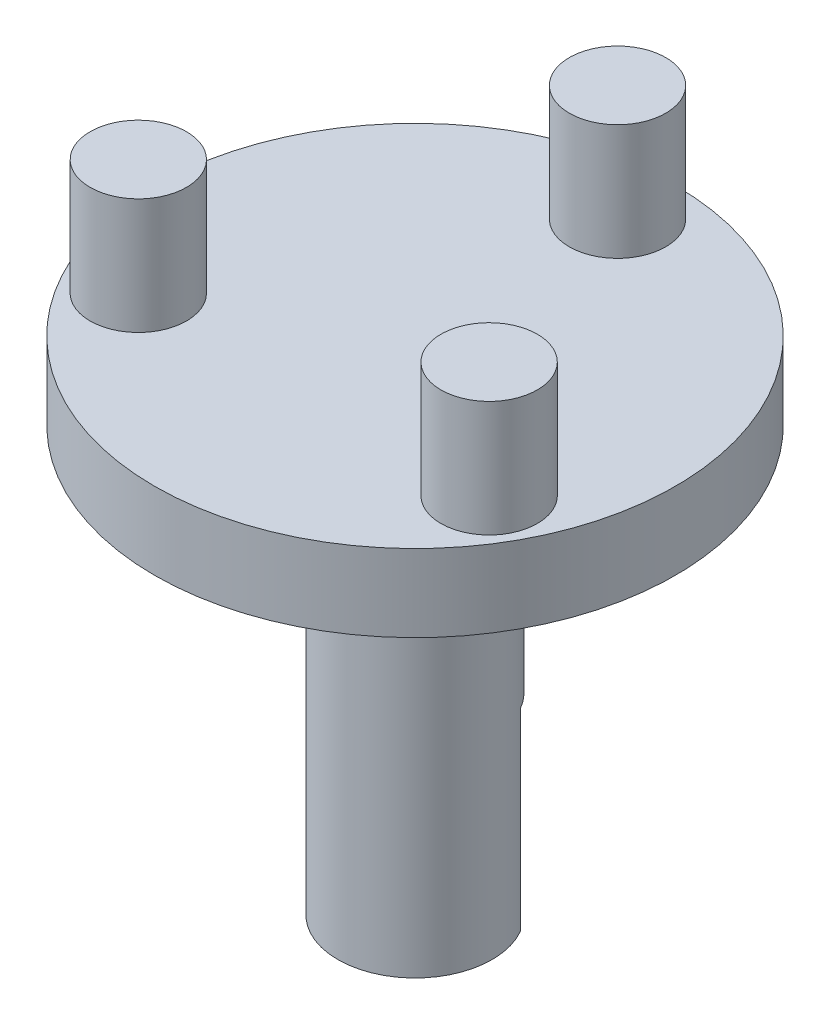
from build123d import *

# Parameters (mm, degrees)
SKETCH_1_R          = 13.5
EXTRUDE_1_DEPTH     = 4
SKETCH_2_R          = 2.5
EXTRUDE_2_DEPTH     = 6
SKETCH_3_R          = 4
EXTRUDE_3_DEPTH     = 7
SKETCH_4_R          = 5.5
EXTRUDE_4_DEPTH     = 1
SKETCH_5_R          = 4
EXTRUDE_5_DEPTH     = 15
CUT_EXTRUDE_START   = -10
CUT_EXTRUDE_1_DEPTH = 10
SKETCH_7_R          = 1.5
CUT_EXTRUDE_2_DEPTH = 1


with BuildPart() as part:
    # 草图1 → 凸台-拉伸1 (new body)
    with BuildSketch(Plane(origin=(0, 0, 0), x_dir=(1, 0, 0), z_dir=(0, 1, 0))):
        with Locations(Location((0, 0, 0), (0, 0, 270))):
            Circle(SKETCH_1_R)
    extrude(amount=EXTRUDE_1_DEPTH)

    # 草图2 → 凸台-拉伸2 (add)
    with BuildSketch(Plane(origin=(0, 4, 0), x_dir=(1, 0, 0), z_dir=(0, 1, 0))):
        with Locations(Location((0, 10.5, 0), (0, 0, 270))):
            Circle(SKETCH_2_R)
        with Locations(Location((9.09326674, -5.25, 0), (0, 0, 270))):
            Circle(SKETCH_2_R)
        with Locations(Location((-9.09326674, -5.25, 0), (0, 0, 270))):
            Circle(SKETCH_2_R)
    extrude(amount=EXTRUDE_2_DEPTH)

    # 草图3 → 凸台-拉伸3 (add)
    with BuildSketch(Plane.XZ):
        with Locations(Location((0, 0, 0), (0, 0, 270))):
            Circle(SKETCH_3_R)
    extrude(amount=EXTRUDE_3_DEPTH)

    # 草图4 → 凸台-拉伸4 (add)
    with BuildSketch(Plane.XZ):
        with Locations(Location((0, 0, 0), (0, 0, 90))):
            Circle(SKETCH_4_R)
    extrude(amount=EXTRUDE_4_DEPTH)

    # 草图5 → 凸台-拉伸5 (add)
    with BuildSketch(Plane.XZ.offset(7)):
        with Locations(Location((0, 0, 0), (0, 0, 270))):
            Circle(SKETCH_5_R)
    extrude(amount=EXTRUDE_5_DEPTH)

    # 草图6 → 切除-拉伸1 (cut)
    with BuildSketch(Plane.XZ.offset(22).offset(CUT_EXTRUDE_START)):
        with BuildLine():
            Line((3.464101615, -2), (-3.464101615, -2))
            ThreePointArc((-3.464101615, -2), (0, -4), (3.464101615, -2))
        make_face()
    extrude(amount=CUT_EXTRUDE_1_DEPTH, mode=Mode.SUBTRACT)

    # 草图7 → 切除-拉伸2 (cut)
    with BuildSketch(Plane(origin=(0, 0, -2), x_dir=(-1, 0, 0), z_dir=(0, 0, -1))):
        with Locations((0, -15.5)):
            Circle(SKETCH_7_R)
    extrude(amount=-CUT_EXTRUDE_2_DEPTH, mode=Mode.SUBTRACT)


solid = part.part
